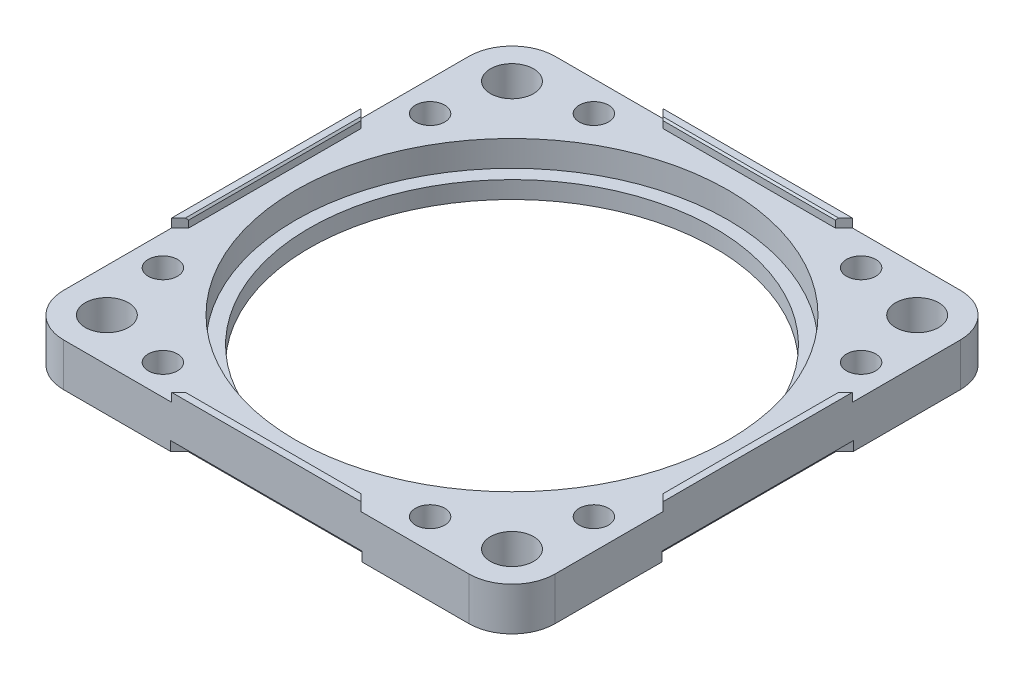
from build123d import *

# Parameters (mm, degrees)
SKETCH_1_W                           = 57
SKETCH_1_H                           = 57
EXTRUDE_1_DEPTH                      = 5
SKETCH_2_R                           = 25.1
CUT_EXTRUDE_1_DEPTH                  = 3
CUT_EXTRUDE_5_DEPTH                  = 41.416580756
CUT_EXTRUDE_5_DEPTH_BACK             = 41.416580756
SKETCH_8_R                           = 23.5
SKETCH_3_R                           = 2.5
SKETCH_3_R_2                         = 1.7
CUT_EXTRUDE_2_DEPTH                  = 41.614036982
CUT_EXTRUDE_4_DEPTH                  = 2.5
EXTRUDE_2_DEPTH                      = 1
CHAMFER_1_SIZE                       = 0.2
CUT_EXTRUDE_3_DEPTH                  = 1.1
PATTERN_CIRCULAR_1_COUNT             = 4
CHAMFER_1_OF_PATTERN_CIRCULAR_1_SIZE = 0.2
FILLET_1_R                           = 5


with BuildPart() as part:
    # 草图1 → 凸台-拉伸1 (new body)
    with BuildSketch(Plane(origin=(0, 0, 0), x_dir=(1, 0, 0), z_dir=(0, 1, 0))):
        Rectangle(SKETCH_1_W, SKETCH_1_H)
    extrude(amount=EXTRUDE_1_DEPTH)

    # 草图2 → 切除-拉伸1 (cut)
    with BuildSketch(Plane(origin=(0, 5, 0), x_dir=(1, 0, 0), z_dir=(0, 1, 0))):
        with Locations(Location((0, 0, 0), (0, 0, 270))):
            Circle(SKETCH_2_R)
    extrude(amount=-CUT_EXTRUDE_1_DEPTH, mode=Mode.SUBTRACT)

    # 草图8 → 切除-拉伸5 (cut, two sides: drawn at the far end of the back side and taken through both)
    with BuildSketch(Plane(origin=(0, 2, 0), x_dir=(1, 0, 0), z_dir=(0, 1, 0)).offset(-CUT_EXTRUDE_5_DEPTH_BACK)):
        with Locations(Location((0, 0, 0), (0, 0, 270))):
            Circle(SKETCH_8_R)
    extrude(amount=CUT_EXTRUDE_5_DEPTH + CUT_EXTRUDE_5_DEPTH_BACK, mode=Mode.SUBTRACT)

    # 草图3 → 切除-拉伸2 (cut, through all)
    with BuildSketch(Plane(origin=(0, 5, 0), x_dir=(1, 0, 0), z_dir=(0, 1, 0))):
        with Locations(Location((23.5, 23.5, 0), (0, 0, 270))):
            Circle(SKETCH_3_R)
        with Locations(Location((25, 15.5, 0), (0, 0, 270))):
            Circle(SKETCH_3_R_2)
        with Locations(Location((15.5, 25, 0), (0, 0, 90))):
            Circle(SKETCH_3_R_2)
    cut_extrude_2 = extrude(amount=-CUT_EXTRUDE_2_DEPTH, mode=Mode.SUBTRACT)

    # 草图7 → 切除-拉伸4 (cut)
    with BuildSketch(Plane.XZ):
        Polygon((27.75, -13.91228676), (25, -12.324573519), (22.25, -13.91228676), (22.25, -17.08771324), (25, -18.675426481), (27.75, -17.08771324), align=None)
    cut_extrude_4 = extrude(amount=-CUT_EXTRUDE_4_DEPTH, mode=Mode.SUBTRACT)

    # 草图4 → 凸台-拉伸2 (add)
    with BuildSketch(Plane(origin=(0, 5, 0), x_dir=(1, 0, 0), z_dir=(0, 1, 0))):
        Polygon((28.5, 11), (27.5, 10), (27.5, -10), (28.5, -11), align=None)
    extrude_2 = extrude(amount=EXTRUDE_2_DEPTH)

    # 倒角1
    chamfer_1_edges = [part.edges().sort_by_distance(p)[0] for p in [
        (27.5, 6, 0),
    ]]
    chamfer(chamfer_1_edges, length=CHAMFER_1_SIZE)

    # 草图5 → 切除-拉伸3 (cut)
    with BuildSketch(Plane.XZ):
        Polygon((28.5, 11.1), (27.5, 10.1), (27.5, -10.1), (28.5, -11.1), align=None)
    cut_extrude_3 = extrude(amount=-CUT_EXTRUDE_3_DEPTH, mode=Mode.SUBTRACT)

    # 阵列(圆周)1: 切除-拉伸2, 切除-拉伸4, 凸台-拉伸2, 切除-拉伸3 ×4 about axis
    pattern_circular_1_axis = Axis((0, 0, 0), (0, 1, 0))
    add([cut_extrude_2.rotate(pattern_circular_1_axis, i * 360 / PATTERN_CIRCULAR_1_COUNT) for i in range(1, PATTERN_CIRCULAR_1_COUNT)], mode=Mode.SUBTRACT)
    add([cut_extrude_4.rotate(pattern_circular_1_axis, i * 360 / PATTERN_CIRCULAR_1_COUNT) for i in range(1, PATTERN_CIRCULAR_1_COUNT)], mode=Mode.SUBTRACT)
    add([extrude_2.rotate(pattern_circular_1_axis, i * 360 / PATTERN_CIRCULAR_1_COUNT) for i in range(1, PATTERN_CIRCULAR_1_COUNT)])
    add([cut_extrude_3.rotate(pattern_circular_1_axis, i * 360 / PATTERN_CIRCULAR_1_COUNT) for i in range(1, PATTERN_CIRCULAR_1_COUNT)], mode=Mode.SUBTRACT)

    # 倒角1 of 阵列(圆周)1
    chamfer_1_of_pattern_circular_1_edges = [part.edges().sort_by_distance(p)[0] for p in [
        (0, 6, -27.5),
        (-27.5, 6, 0),
        (0, 6, 27.5),
    ]]
    chamfer(chamfer_1_of_pattern_circular_1_edges, length=CHAMFER_1_OF_PATTERN_CIRCULAR_1_SIZE)

    # 圆角1
    fillet_1_edges = [part.edges().sort_by_distance(p)[0] for p in [
        (28.5, 2.5, 28.5),
        (-28.5, 2.5, 28.5),
        (-28.5, 2.5, -28.5),
        (28.5, 2.5, -28.5),
    ]]
    fillet(fillet_1_edges, radius=FILLET_1_R)


solid = part.part
